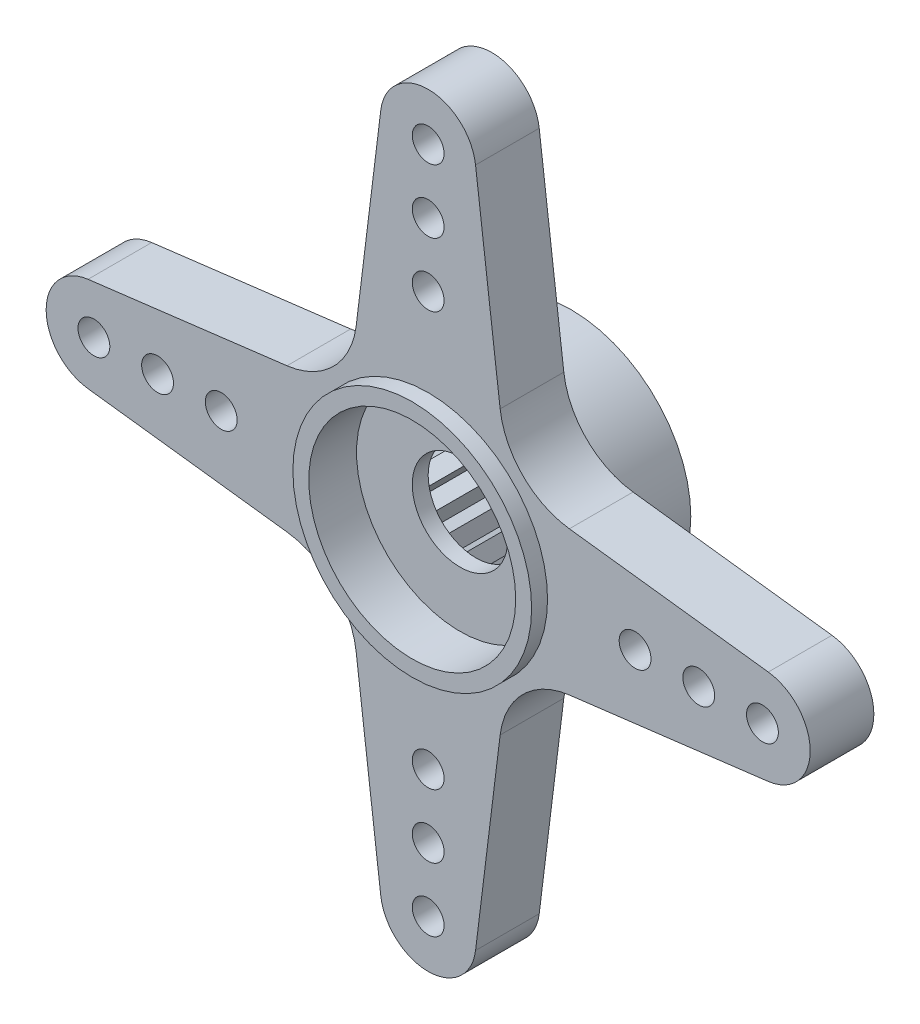
from build123d import *

# Parameters (mm, degrees)
ESQUISSE1_R                  = 0.5
BASE_EXTRUSION_DEPTH         = 1
ESQUISSE2_R                  = 3.75
BOSS_EXTRU_1_DEPTH           = 0.5
BOSS_EXTRU_2_START           = 2.5
ESQUISSE3_R                  = 3.75
BOSS_EXTRU_2_DEPTH           = 2.5
ESQUISSE4_R                  = 3.25
ENL_V_MAT_EXTRU_1_DEPTH      = 1.5
ESQUISSE5_R                  = 1.5
ENL_V_MAT_EXTRU_2_DEPTH      = 18.327723451
ESQUISSE7_R                  = 2.2
ENL_V_MAT_EXTRU_4_DEPTH      = 3
DENTS_DEPTH                  = 3
R_P_TITION_CIRCULAIRE1_COUNT = 24


with BuildPart() as part:
    # Esquisse1 → Base-Extrusion (new, symmetric)
    with BuildSketch(Plane.XY):
        with BuildLine():
            Line((1.488676655, 10.683961455), (2.260839574, 4.435364907))
            ThreePointArc((2.260839574, 4.435364907), (2.974200379, 2.974200379), (4.435364907, 2.260839574))
            Line((4.435364907, 2.260839574), (10.683961455, 1.488676655))
            ThreePointArc((10.683961455, 1.488676655), (12, 0), (10.683961455, -1.488676655))
            Line((10.683961455, -1.488676655), (4.435364907, -2.260839574))
            ThreePointArc((4.435364907, -2.260839574), (2.974200379, -2.974200379), (2.260839574, -4.435364907))
            Line((2.260839574, -4.435364907), (1.488676655, -10.683961455))
            ThreePointArc((1.488676655, -10.683961455), (0, -12), (-1.488676655, -10.683961455))
            Line((-1.488676655, -10.683961455), (-2.260839574, -4.435364907))
            ThreePointArc((-2.260839574, -4.435364907), (-2.974200379, -2.974200379), (-4.435364907, -2.260839574))
            Line((-4.435364907, -2.260839574), (-10.683961455, -1.488676655))
            ThreePointArc((-10.683961455, -1.488676655), (-12, 0), (-10.683961455, 1.488676655))
            Line((-10.683961455, 1.488676655), (-4.435364907, 2.260839574))
            ThreePointArc((-4.435364907, 2.260839574), (-2.974200379, 2.974200379), (-2.260839574, 4.435364907))
            Line((-2.260839574, 4.435364907), (-1.488676655, 10.683961455))
            ThreePointArc((-1.488676655, 10.683961455), (0, 12), (1.488676655, 10.683961455))
        make_face()
        with Locations((10.5, 0)):
            Circle(ESQUISSE1_R, mode=Mode.SUBTRACT)
        with Locations((8.5, 0)):
            Circle(ESQUISSE1_R, mode=Mode.SUBTRACT)
        with Locations((6.5, 0)):
            Circle(ESQUISSE1_R, mode=Mode.SUBTRACT)
        with Locations(Location((0, -10.5, 0), (0, 0, 180))):
            Circle(ESQUISSE1_R, mode=Mode.SUBTRACT)
        with Locations(Location((0, -8.5, 0), (0, 0, 180))):
            Circle(ESQUISSE1_R, mode=Mode.SUBTRACT)
        with Locations(Location((0, -6.5, 0), (0, 0, 180))):
            Circle(ESQUISSE1_R, mode=Mode.SUBTRACT)
        with Locations((0, 10.5)):
            Circle(ESQUISSE1_R, mode=Mode.SUBTRACT)
        with Locations((0, 8.5)):
            Circle(ESQUISSE1_R, mode=Mode.SUBTRACT)
        with Locations((0, 6.5)):
            Circle(ESQUISSE1_R, mode=Mode.SUBTRACT)
        with Locations(Location((-10.5, 0, 0), (0, 0, 180))):
            Circle(ESQUISSE1_R, mode=Mode.SUBTRACT)
        with Locations(Location((-8.5, 0, 0), (0, 0, 180))):
            Circle(ESQUISSE1_R, mode=Mode.SUBTRACT)
        with Locations(Location((-6.5, 0, 0), (0, 0, 180))):
            Circle(ESQUISSE1_R, mode=Mode.SUBTRACT)
    extrude(amount=BASE_EXTRUSION_DEPTH, both=True)

    # Esquisse2 → Boss.-Extru.1 (add)
    with BuildSketch(Plane.XY.offset(1)):
        with Locations(Location((0, 0, 0), (0, 0, 180))):
            Circle(ESQUISSE2_R)
    extrude(amount=BOSS_EXTRU_1_DEPTH)

    # Esquisse3 → Boss.-Extru.2 (add)
    with BuildSketch(Plane(origin=(0, 0, -1), x_dir=(-1, 0, 0), z_dir=(0, 0, -1)).offset(BOSS_EXTRU_2_START)):
        Circle(ESQUISSE3_R)
    extrude(amount=-BOSS_EXTRU_2_DEPTH)

    # Esquisse4 → Enlèv. mat.-Extru.1 (cut)
    with BuildSketch(Plane.XY.offset(1.5)):
        Circle(ESQUISSE4_R)
    extrude(amount=-ENL_V_MAT_EXTRU_1_DEPTH, mode=Mode.SUBTRACT)

    # Esquisse5 → Enlèv. mat.-Extru.2 (cut, through all)
    with BuildSketch(Plane.XY):
        Circle(ESQUISSE5_R)
    extrude(amount=-ENL_V_MAT_EXTRU_2_DEPTH, mode=Mode.SUBTRACT)

    # Esquisse7 → Enlèv. mat.-Extru.4 (cut)
    with BuildSketch(Plane(origin=(0, 0, -3.5), x_dir=(-1, 0, 0), z_dir=(0, 0, -1))):
        Circle(ESQUISSE7_R)
    extrude(amount=-ENL_V_MAT_EXTRU_4_DEPTH, mode=Mode.SUBTRACT)

    # Esquisse6 → Dents (cut)
    with BuildSketch(Plane(origin=(0, 0, -3.5), x_dir=(-1, 0, 0), z_dir=(0, 0, -1))):
        with BuildLine():
            Line((0, 2.8), (0.288653169, 2.180981281))
            ThreePointArc((0.288653169, 2.180981281), (0, 2.2), (-0.288653169, 2.180981281))
            Line((-0.288653169, 2.180981281), (0, 2.8))
        make_face()
    dents = extrude(amount=-DENTS_DEPTH, mode=Mode.SUBTRACT)

    # Répétition circulaire1: Dents ×24 about axis
    r_p_tition_circulaire1_axis = Axis((0, 0, 0), (0, 0, 1))
    for i in range(1, R_P_TITION_CIRCULAIRE1_COUNT):
        add(dents.rotate(r_p_tition_circulaire1_axis, i * 360 / R_P_TITION_CIRCULAIRE1_COUNT), mode=Mode.SUBTRACT)


solid = part.part
